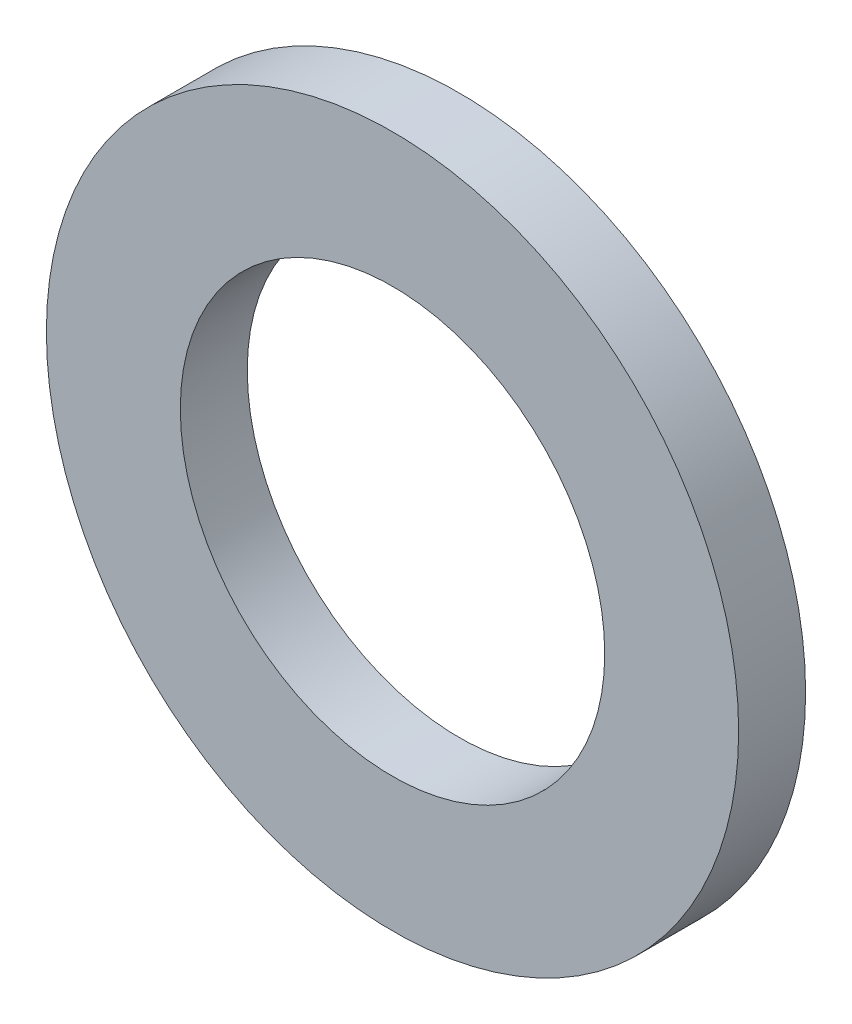
from build123d import *

# Parameters (mm, degrees)
SKETCH1_R           = 6.565
SKETCH1_R_2         = 4.025
BOSS_EXTRUDE1_DEPTH = 1.27


with BuildPart() as part:
    # Sketch1 → Boss-Extrude1 (new body)
    with BuildSketch(Plane.XY):
        Circle(SKETCH1_R)
        Circle(SKETCH1_R_2, mode=Mode.SUBTRACT)
    extrude(amount=BOSS_EXTRUDE1_DEPTH)


solid = part.part
